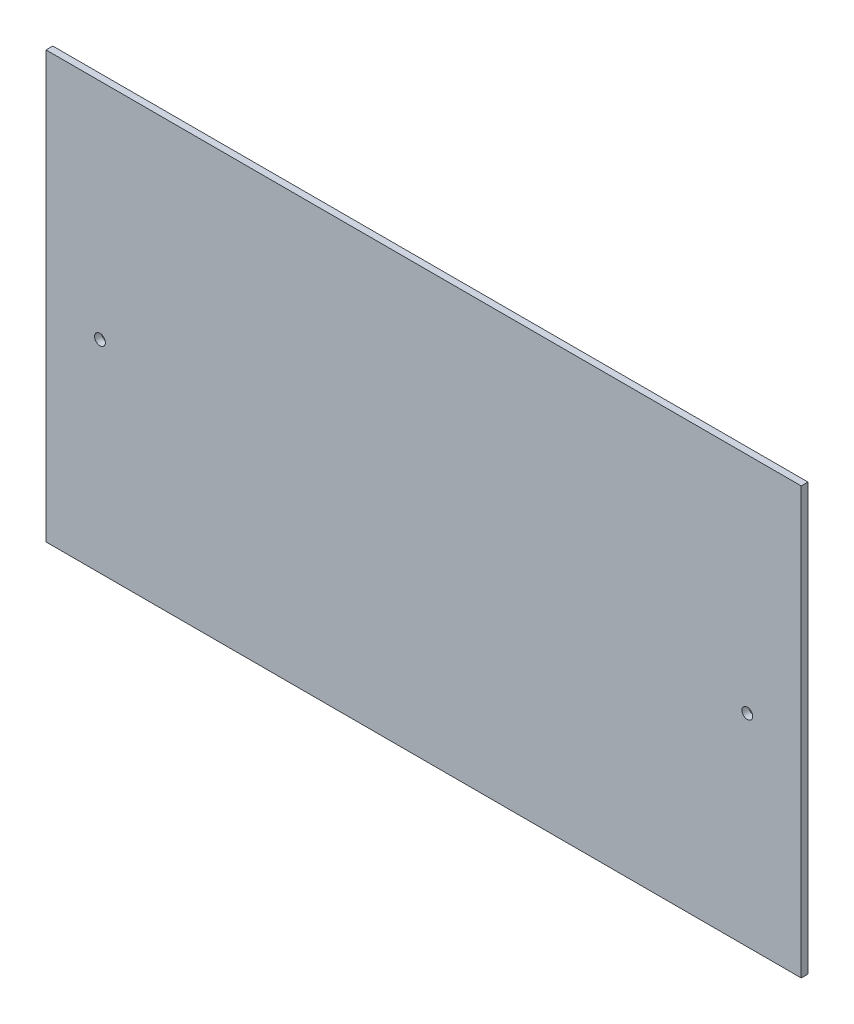
from build123d import *

# Parameters (mm, degrees)
SCHIZZO1_W                   = 280
SCHIZZO1_H                   = 158
ESTRUSIONE_ESTRUSIONE1_DEPTH = 2.5
SCHIZZO2_R                   = 2
TAGLIO_ESTRUSIONE1_DEPTH     = 10


with BuildPart() as part:
    # Schizzo1 → Estrusione-Estrusione1 (new body)
    with BuildSketch(Plane.XY):
        with Locations((140, 79)):
            Rectangle(SCHIZZO1_W, SCHIZZO1_H)
    extrude(amount=ESTRUSIONE_ESTRUSIONE1_DEPTH)

    # Schizzo2 → Taglio-Estrusione1 (cut)
    with BuildSketch(Plane.XY.offset(2.5)):
        with Locations((260, 75)):
            Circle(SCHIZZO2_R)
        with Locations((20, 75)):
            Circle(SCHIZZO2_R)
    extrude(amount=-TAGLIO_ESTRUSIONE1_DEPTH, mode=Mode.SUBTRACT)


solid = part.part
